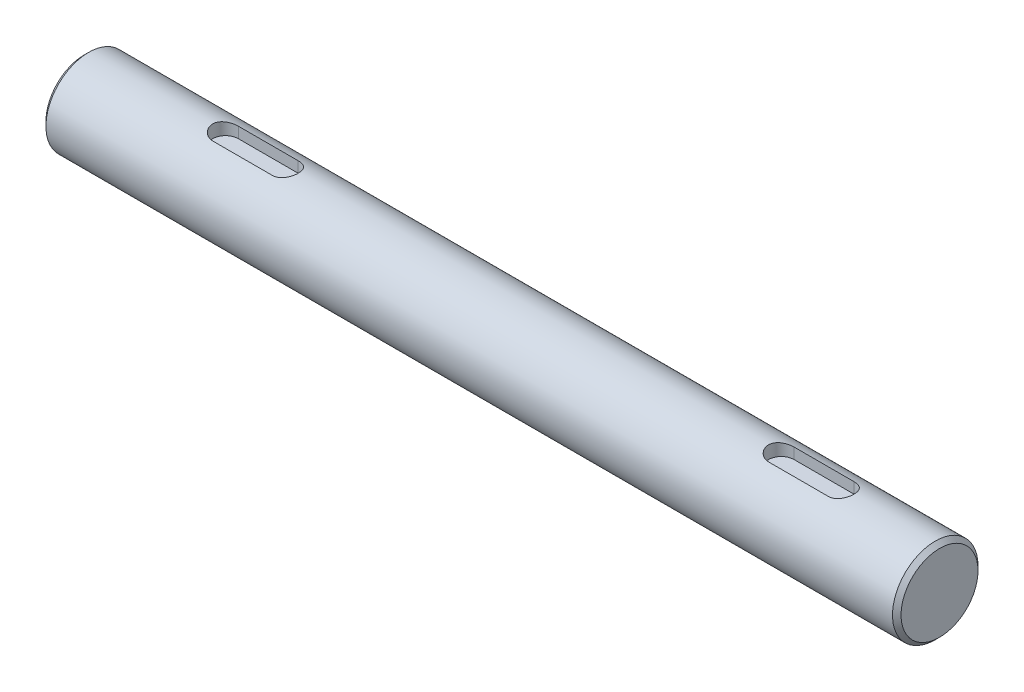
from build123d import *

# Parameters (mm, degrees)
SKETCH_1_R             = 10
EXTRUDE_1_DEPTH        = 200
CUT_EXTRUDE_1_DEPTH    = 3
CHAMFER_1_SIZE         = 1
PATTERN_LINEAR_1_COUNT = 3
PATTERN_LINEAR_1_PITCH = 130
CHAMFER_2_SIZE         = 1


with BuildPart() as part:
    # 草图1 → 凸台-拉伸1 (new body)
    with BuildSketch(Plane(origin=(0, 0, 0), x_dir=(0, 0, -1), z_dir=(1, 0, 0))):
        Circle(SKETCH_1_R)
    extrude(amount=EXTRUDE_1_DEPTH)

    # 草图2 → 切除-拉伸1 (cut)
    with BuildSketch(Plane(origin=(0, 10, 0), x_dir=(1, 0, 0), z_dir=(0, 1, 0))):
        with BuildLine():
            Line((33, 3), (47, 3))
            ThreePointArc((47, 3), (50, 0), (47, -3))
            Line((47, -3), (33, -3))
            ThreePointArc((33, -3), (30, 0), (33, 3))
        make_face()
    cut_extrude_1 = extrude(amount=-CUT_EXTRUDE_1_DEPTH, mode=Mode.SUBTRACT)

    # 倒角1
    chamfer_1_edges = [part.edges().sort_by_distance(p)[0] for p in [
        (0, 0, 10),
    ]]
    chamfer(chamfer_1_edges, length=CHAMFER_1_SIZE)

    # 阵列(线性)1: 切除-拉伸1 ×3
    with Locations(*[(i * PATTERN_LINEAR_1_PITCH, 0, 0) for i in range(1, PATTERN_LINEAR_1_COUNT)]):
        add(cut_extrude_1, mode=Mode.SUBTRACT)

    # 倒角2
    chamfer_2_edges = [part.edges().sort_by_distance(p)[0] for p in [
        (200, 0, 10),
    ]]
    chamfer(chamfer_2_edges, length=CHAMFER_2_SIZE)


solid = part.part
